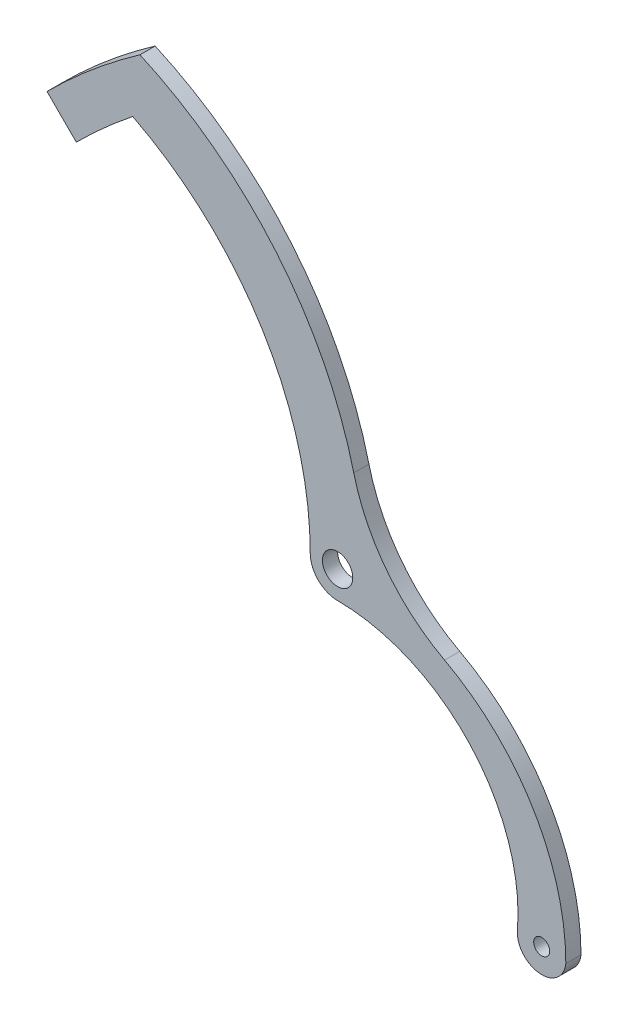
from build123d import *

# Parameters (mm, degrees)
SKETCH1_R           = 5
SKETCH1_R_2         = 2.630242902
BOSS_EXTRUDE1_DEPTH = 5


with BuildPart() as part:
    # Sketch1 → Boss-Extrude1 (new body)
    with BuildSketch(Plane.XY):
        with BuildLine():
            ThreePointArc((-132.270242639, 188.16105578), (-148.132436646, 175.945392703), (-162.872207874, 162.396563703))
            Line((-162.872207874, 162.396563703), (-153.220049521, 152.772593049))
            ThreePointArc((-153.220049521, 152.772593049), (-144.175949012, 161.335502877), (-134.654137313, 169.363845217))
            ThreePointArc((-134.654137313, 169.363845217), (-91.974174204, 129.962156064), (-76.195, 74.059651464))
            ThreePointArc((-76.195, 74.059651464), (-73.571522122, 67.708276367), (-67.230563194, 65.059721728))
            ThreePointArc((-67.230563194, 65.059721728), (-23.540861603, 45.781560748), (-7.974687844, 0.635888194))
            ThreePointArc((-7.974687844, 0.635888194), (-0.758972679, -7.963916152), (7.951244839, -0.881876127))
            ThreePointArc((7.951244839, -0.881876127), (-2.808500316, 37.921764044), (-31.962523765, 65.698328321))
            ThreePointArc((-31.962523765, 65.698328321), (-50.993465666, 81.748695293), (-61.871355452, 104.142054652))
            ThreePointArc((-61.871355452, 104.142054652), (-87.362753882, 154.285853019), (-132.270242639, 188.16105578))
        make_face()
        with Locations((-67.195, 74.059651464)):
            Circle(SKETCH1_R, mode=Mode.SUBTRACT)
        Circle(SKETCH1_R_2, mode=Mode.SUBTRACT)
    extrude(amount=BOSS_EXTRUDE1_DEPTH)


solid = part.part
